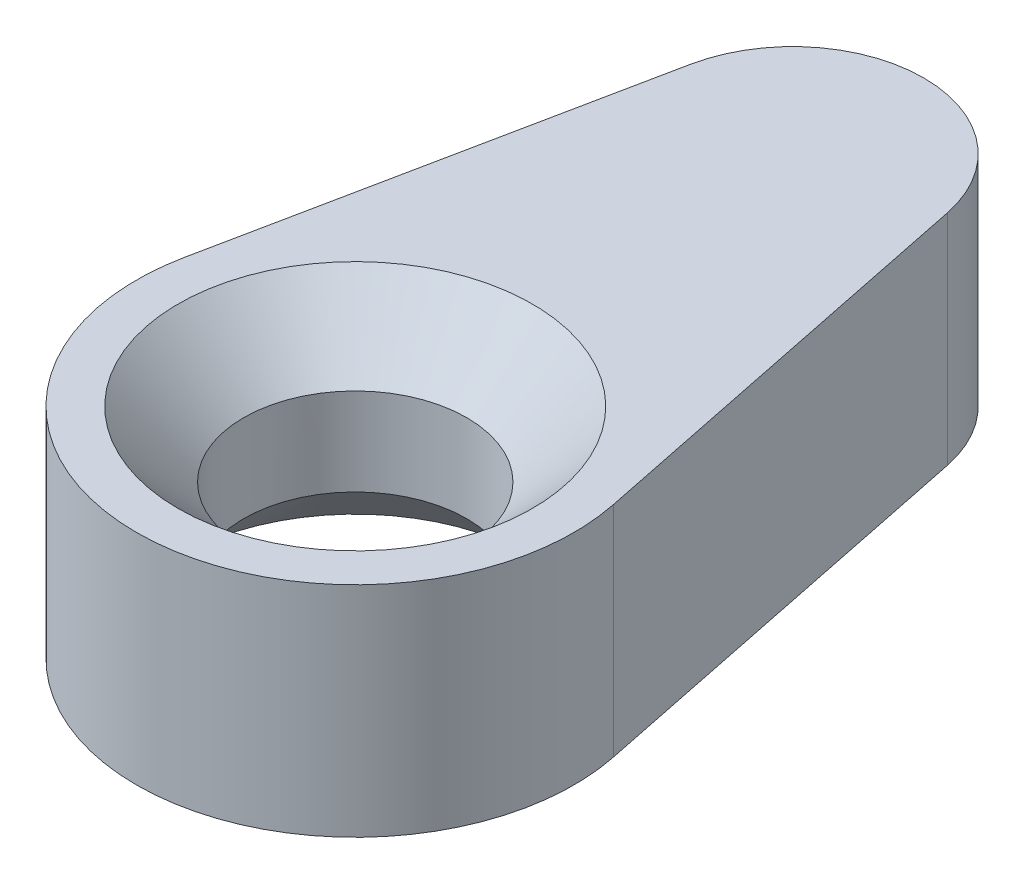
from build123d import *

# Parameters (mm, degrees)
SKETCH1_R           = 12.7
SKETCH1_R_2         = 6.477
BOSS_EXTRUDE1_DEPTH = 12.7
CHAMFER1_SIZE       = 3.81


with BuildPart() as part:
    # Sketch1 → Boss-Extrude1 (new body)
    # profile 1 of 2: a face of its own
    with BuildSketch(Plane(origin=(0, 0, 0), x_dir=(1, 0, 0), z_dir=(0, 1, 0))):
        with BuildLine():
            Line((-7.466044736, 26.924), (-12.443407893, 2.54))
            ThreePointArc((-12.443407893, 2.54), (0, 12.7), (12.443407893, 2.54))
            Line((12.443407893, 2.54), (7.466044736, 26.924))
            ThreePointArc((7.466044736, 26.924), (0, 33.02), (-7.466044736, 26.924))
        make_face()
    # profile 2 of 2: a face of its own
    with BuildSketch(Plane(origin=(0, 0, 0), x_dir=(1, 0, 0), z_dir=(0, 1, 0))):
        Circle(SKETCH1_R)
        with Locations(Location((0, 0, 0), (0, 0, 270))):
            Circle(SKETCH1_R_2, mode=Mode.SUBTRACT)
    extrude(amount=BOSS_EXTRUDE1_DEPTH)

    # Chamfer1
    chamfer1_edges = [part.edges().sort_by_distance(p)[0] for p in [
        (0, 12.7, -6.477),
        (0, 0, -6.477),
    ]]
    chamfer(chamfer1_edges, length=CHAMFER1_SIZE)


solid = part.part
